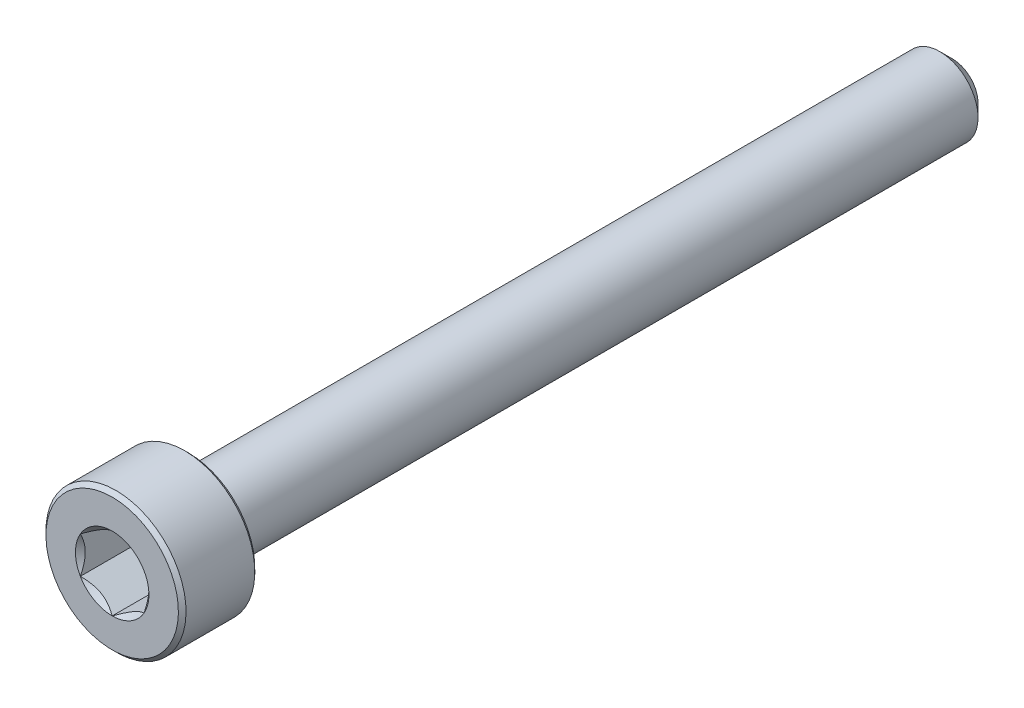
from build123d import *

# Parameters (mm, degrees)
CUT_EXTRUDE1_DEPTH = 2


with BuildPart() as part:
    # Sketch2 → Revolve1 (revolve)
    with BuildSketch(Plane(origin=(0, 0, 0), x_dir=(0, 0, -1), z_dir=(1, 0, 0))):
        Polygon((-16.5, 0), (-16.5, 2.6), (-16.35, 2.75), (-13.65, 2.75), (-13.5, 2.6), (-13.5, 1.5), (16, 1.5), (16.5, 1), (16.5, 0), align=None)
    revolve(axis=Axis((0, 0, -16.5), (0, 0, 1)))

    # Sketch3 → Cut-Extrude1 (cut)
    with BuildSketch(Plane.XY.offset(16.5)):
        Polygon((1.25, -0.721687836), (1.25, 0.721687836), (0, 1.443375673), (-1.25, 0.721687836), (-1.25, -0.721687836), (0, -1.443375673), align=None)
    extrude(amount=-CUT_EXTRUDE1_DEPTH, mode=Mode.SUBTRACT)

    # Cut-Extrude2 cone 1 section (through the dimple's axis) → Cut-Extrude2 (revolve, cut)
    with BuildSketch(Plane(origin=(0, 0, 16.5), x_dir=(0, -1, 0), z_dir=(1, 0, 0))):
        Polygon((0, 0), (1.443375673, 0), (0, 1.443375673), align=None)
    revolve(axis=Axis((0, 0, 16.5), (0, 0, -1)), mode=Mode.SUBTRACT)


solid = part.part
